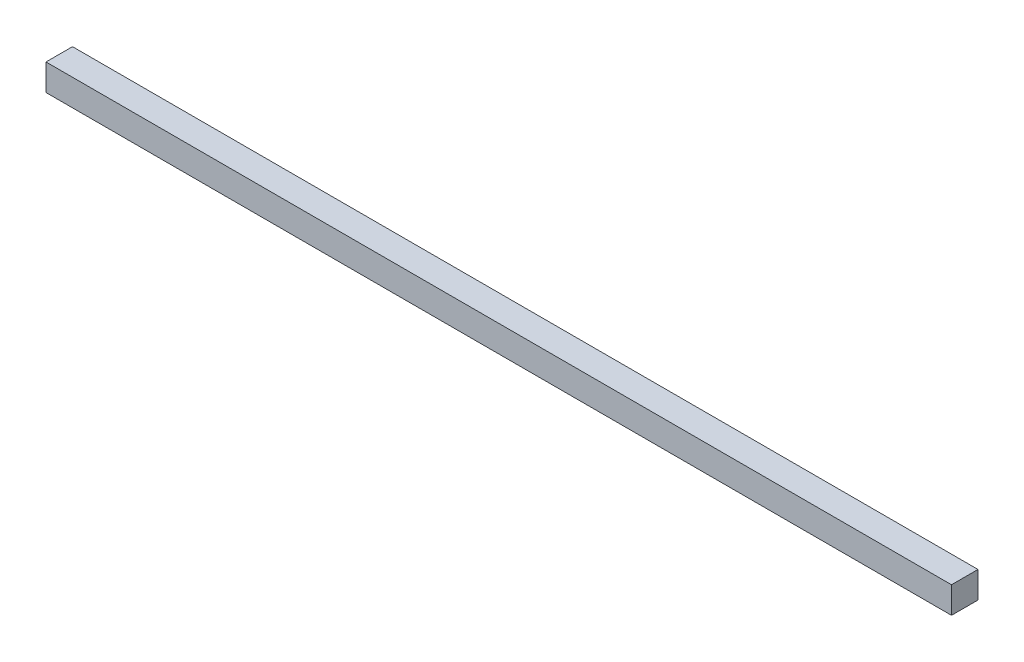
from build123d import *

# Parameters (mm, degrees)
SKETCH_1_W      = 9
SKETCH_1_H      = 9
EXTRUDE_1_DEPTH = 307.5


with BuildPart() as part:
    # Эскиз1 → Бобышка-Вытянуть1 (new body)
    with BuildSketch(Plane(origin=(0, 0, 0), x_dir=(0, 0, -1), z_dir=(1, 0, 0))):
        with Locations((4.5, 4.5)):
            Rectangle(SKETCH_1_W, SKETCH_1_H)
    extrude(amount=EXTRUDE_1_DEPTH)


solid = part.part
